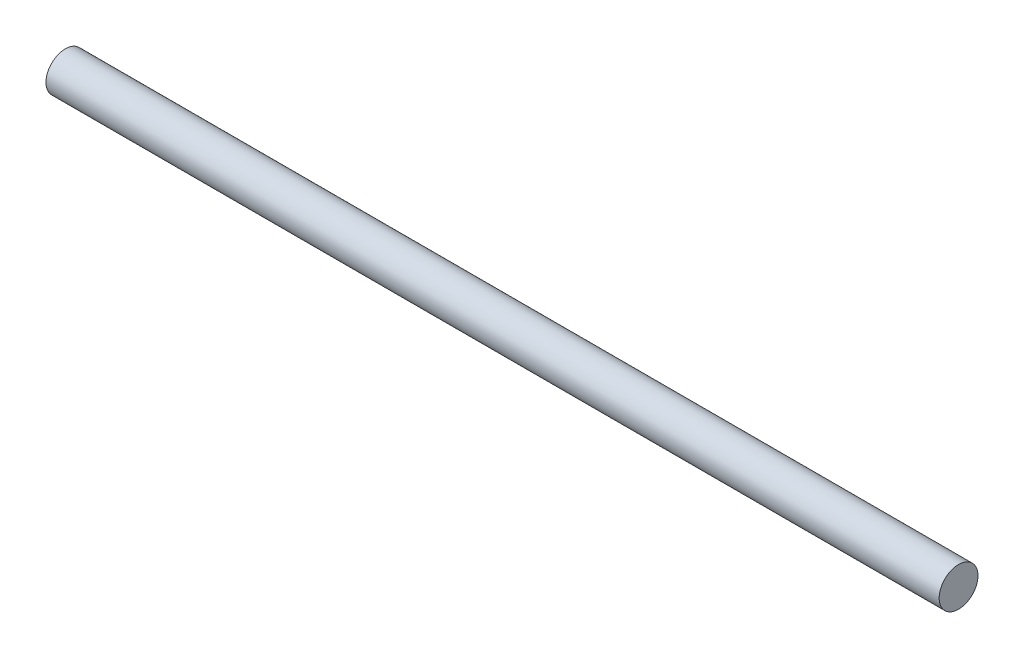
from build123d import *

# Parameters (mm, degrees)
SKETCH3_R           = 5
BOSS_EXTRUDE1_DEPTH = 230


with BuildPart() as part:
    # Sketch3 → Boss-Extrude1 (new body)
    with BuildSketch(Plane(origin=(0, 0, 0), x_dir=(0, 0, -1), z_dir=(1, 0, 0))):
        with Locations((-0.358321314, 0.248258056)):
            Circle(SKETCH3_R)
    extrude(amount=BOSS_EXTRUDE1_DEPTH)


solid = part.part
